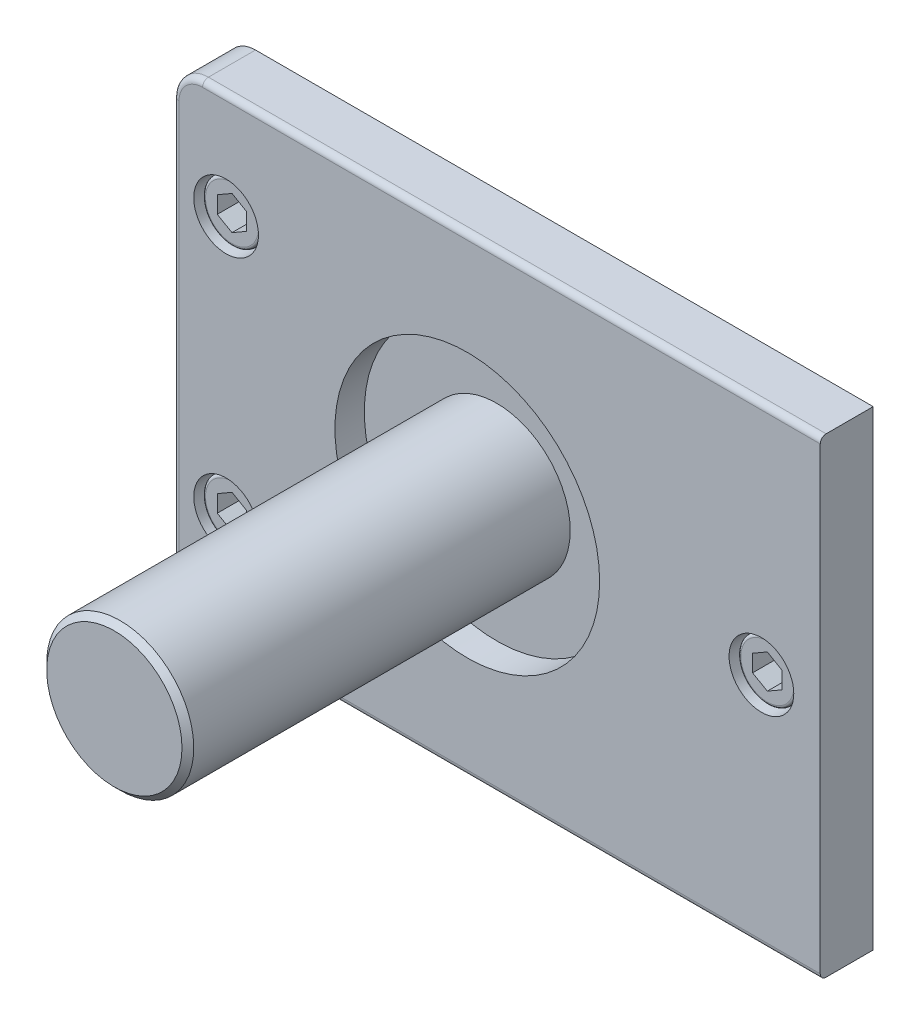
from build123d import *

# Parameters (mm, degrees)
BOSS_EXTRU_1_DEPTH               = 9
CONG_1_R                         = 1
ESQUISSE4_R                      = 5.5
ENL_V_MAT_EXTRU_1_DEPTH          = 7
ESQUISSE5_R                      = 5
BOSS_EXTRU_2_DEPTH               = 6
CONG_2_R                         = 0.5
ENL_V_MAT_EXTRU_2_DEPTH          = 4
R_P_TITION_LIN_AIRE1_COUNT       = 2
R_P_TITION_LIN_AIRE1_PITCH       = 44
CONG_2_OF_R_P_TITION_LIN_AIRE1_R = 0.5
ESQUISSE7_R                      = 5.5
ENL_V_MAT_EXTRU_3_DEPTH          = 7
ESQUISSE8_R                      = 5
BOSS_EXTRU_3_DEPTH               = 6
CONG_3_R                         = 0.5
ENL_V_MAT_EXTRU_4_DEPTH          = 5
ESQUISSE10_R                     = 3
ENL_V_MAT_EXTRU_5_DEPTH          = 5
ESQUISSE12_R                     = 22.5
ENL_V_MAT_EXTRU_7_DEPTH          = 5
ESQUISSE14_R                     = 12.5
BOSS_EXTRU_4_DEPTH               = 65
CHANFREIN1_SIZE                  = 1


with BuildPart() as part:
    # Esquisse1 → Boss.-Extru.1 (new body)
    with BuildSketch(Plane(origin=(0, 0, 0), x_dir=(-1, 0, 0), z_dir=(0, 0, 1))):
        with BuildLine():
            Line((0, 5), (0, 75))
            ThreePointArc((0, 75), (-1.464466094, 78.535533906), (-5, 80))
            Line((-5, 80), (-110, 80))
            Line((-110, 80), (-110, 0))
            Line((-110, 0), (-5, 0))
            ThreePointArc((-5, 0), (-1.464466094, 1.464466094), (0, 5))
        make_face()
    extrude(amount=BOSS_EXTRU_1_DEPTH)

    # Congé1
    cong_1_edges = [part.edges().sort_by_distance(p)[0] for p in [
        (1.464466094, -78.535533906, 9),
        (57.5, -80, 9),
        (57.5, 0, 9),
        (1.464466094, -1.464466094, 9),
        (0, -40, 9),
    ]]
    fillet(cong_1_edges, radius=CONG_1_R)

    # Esquisse4 → Enlèv. mat.-Extru.1 (cut)
    with BuildSketch(Plane.XY.offset(9)):
        with Locations((9, -18)):
            Circle(ESQUISSE4_R)
    enl_v_mat_extru_1 = extrude(amount=-ENL_V_MAT_EXTRU_1_DEPTH, mode=Mode.SUBTRACT)

    # Esquisse5 → Boss.-Extru.2 (add)
    with BuildSketch(Plane.XY.offset(2)):
        with Locations((9, -18)):
            Circle(ESQUISSE5_R)
    boss_extru_2 = extrude(amount=BOSS_EXTRU_2_DEPTH)

    # Congé2
    cong_2_edges = [part.edges().sort_by_distance(p)[0] for p in [
        (4, -18, 8),
    ]]
    fillet(cong_2_edges, radius=CONG_2_R)

    # Esquisse6 → Enlèv. mat.-Extru.2 (cut)
    with BuildSketch(Plane.XY.offset(8)):
        Polygon((9, -15.113248654), (6.5, -16.556624327), (6.5, -19.443375673), (9, -20.886751346), (11.5, -19.443375673), (11.5, -16.556624327), align=None)
    enl_v_mat_extru_2 = extrude(amount=-ENL_V_MAT_EXTRU_2_DEPTH, mode=Mode.SUBTRACT)

    # Répétition linéaire1: Enlèv. mat.-Extru.1, Boss.-Extru.2, Enlèv. mat.-Extru.2 ×2
    with Locations(*[(0, -i * R_P_TITION_LIN_AIRE1_PITCH, 0) for i in range(1, R_P_TITION_LIN_AIRE1_COUNT)]):
        add(enl_v_mat_extru_1, mode=Mode.SUBTRACT)
        add(boss_extru_2)
        add(enl_v_mat_extru_2, mode=Mode.SUBTRACT)

    # Congé2 of Répétition linéaire1
    cong_2_of_r_p_tition_lin_aire1_edges = [part.edges().sort_by_distance(p)[0] for p in [
        (4, -62, 8),
    ]]
    fillet(cong_2_of_r_p_tition_lin_aire1_edges, radius=CONG_2_OF_R_P_TITION_LIN_AIRE1_R)

    # Esquisse7 → Enlèv. mat.-Extru.3 (cut)
    with BuildSketch(Plane.XY.offset(9)):
        with Locations((100, -40)):
            Circle(ESQUISSE7_R)
    extrude(amount=-ENL_V_MAT_EXTRU_3_DEPTH, mode=Mode.SUBTRACT)

    # Esquisse8 → Boss.-Extru.3 (add)
    with BuildSketch(Plane.XY.offset(2)):
        with Locations((100, -40)):
            Circle(ESQUISSE8_R)
    extrude(amount=BOSS_EXTRU_3_DEPTH)

    # Congé3
    cong_3_edges = [part.edges().sort_by_distance(p)[0] for p in [
        (95, -40, 8),
    ]]
    fillet(cong_3_edges, radius=CONG_3_R)

    # Esquisse9 → Enlèv. mat.-Extru.4 (cut)
    with BuildSketch(Plane.XY.offset(8)):
        Polygon((100, -37.113248654), (97.5, -38.556624327), (97.5, -41.443375673), (100, -42.886751346), (102.5, -41.443375673), (102.5, -38.556624327), align=None)
    extrude(amount=-ENL_V_MAT_EXTRU_4_DEPTH, mode=Mode.SUBTRACT)

    # Esquisse10 → Enlèv. mat.-Extru.5 (cut)
    with BuildSketch(Plane(origin=(0, 0, 0), x_dir=(-1, 0, 0), z_dir=(0, 0, -1))):
        with Locations((-6, -40)):
            Circle(ESQUISSE10_R)
    extrude(amount=-ENL_V_MAT_EXTRU_5_DEPTH, mode=Mode.SUBTRACT)

    # Esquisse12 → Enlèv. mat.-Extru.7 (cut)
    with BuildSketch(Plane.XY.offset(9)):
        with Locations((50, -40)):
            Circle(ESQUISSE12_R)
    extrude(amount=-ENL_V_MAT_EXTRU_7_DEPTH, mode=Mode.SUBTRACT)

    # Esquisse14 → Boss.-Extru.4 (add)
    with BuildSketch(Plane.XY.offset(4)):
        with Locations((50, -40)):
            Circle(ESQUISSE14_R)
    extrude(amount=BOSS_EXTRU_4_DEPTH)

    # Chanfrein1
    chanfrein1_edges = [part.edges().sort_by_distance(p)[0] for p in [
        (37.5, -40, 69),
    ]]
    chamfer(chanfrein1_edges, length=CHANFREIN1_SIZE)


solid = part.part
